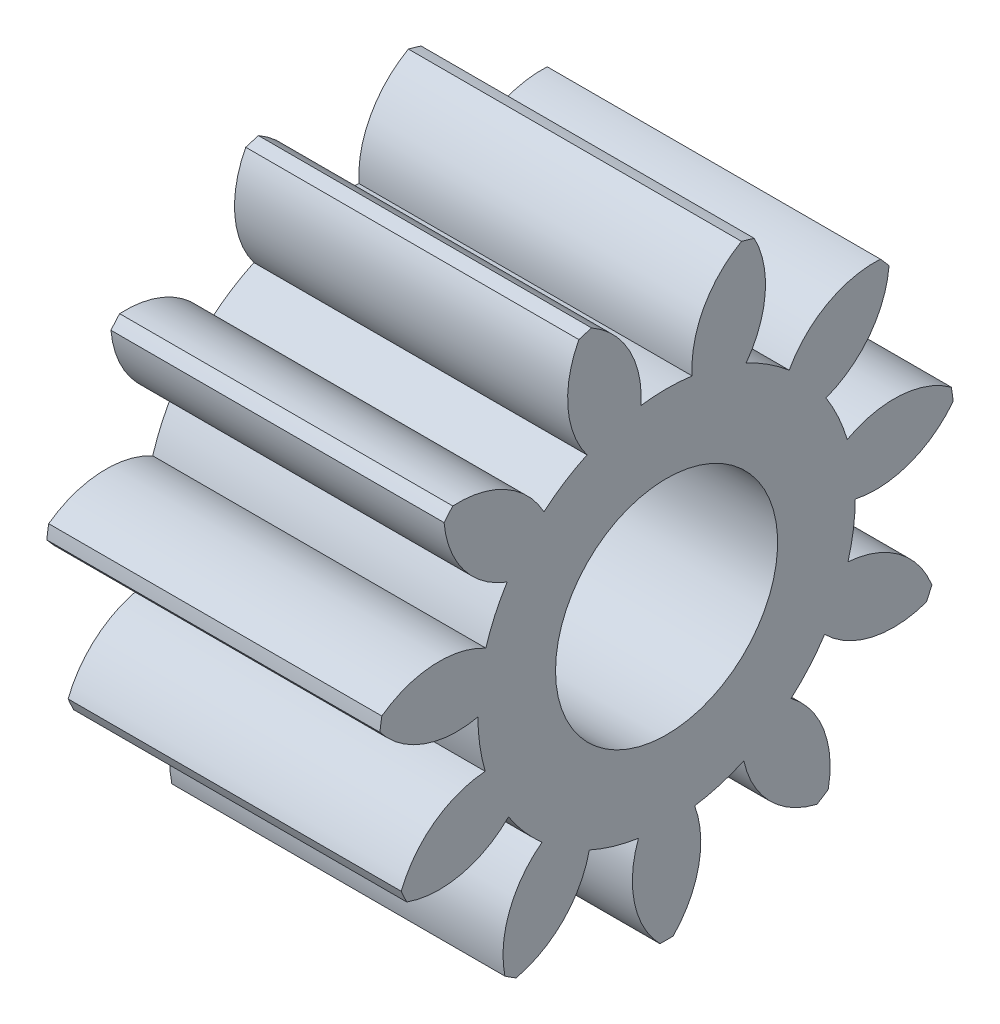
from build123d import *

# Parameters (mm, degrees)
BASPROSKE_W     = 4.5
BASPROSKE_H     = 3.9
TOOTHCUT_DEPTH  = 8.118286311
TEETHCUTS_COUNT = 11
TEETHCUTS_ANGLE = 327.272727273
BORSKE_R        = 1.5
BORE_DEPTH      = 50.0000508


with BuildPart() as part:
    # BasProSke → Base-Revolve (revolve)
    with BuildSketch(Plane(origin=(0, 0, 0), x_dir=(1, 0, 0), z_dir=(0, 1, 0)), mode=Mode.PRIVATE) as base_revolve_sk:
        with Locations((2.25, 1.95)):
            Rectangle(BASPROSKE_W, BASPROSKE_H)
    revolve(base_revolve_sk.sketch.rotate(Axis((-10, 0, 0), (1, 0, 0)), 180), axis=Axis((-10, 0, 0), (1, 0, 0)))

    # TooCutSke → ToothCut (cut, through all)
    with BuildSketch(Plane(origin=(0, 0, 0), x_dir=(0, 0, -1), z_dir=(1, 0, 0))):
        with BuildLine():
            ThreePointArc((0.345926135, 2.525418007), (0, 2.549), (-0.345926135, 2.525418007))
            ThreePointArc((-0.345926135, 2.525418007), (-0.508630204, 3.258246769), (-1.044575138, 3.783864155))
            ThreePointArc((-1.044575138, 3.783864155), (0, 3.9254), (1.044575138, 3.783864155))
            ThreePointArc((1.044575138, 3.783864155), (0.508630204, 3.258246769), (0.345926135, 2.525418007))
        make_face()
    toothcut = extrude(amount=TOOTHCUT_DEPTH, mode=Mode.SUBTRACT)

    # TeethCuts: ToothCut ×11 about axis
    teethcuts_axis = Axis((-10, 0, 0), (1, 0, 0))
    for i in range(1, TEETHCUTS_COUNT):
        add(toothcut.rotate(teethcuts_axis, i * TEETHCUTS_ANGLE / (TEETHCUTS_COUNT - 1)), mode=Mode.SUBTRACT)

    # BorSke → Bore (cut, symmetric)
    with BuildSketch(Plane(origin=(0, 0, 0), x_dir=(0, 0, -1), z_dir=(1, 0, 0))):
        with Locations(Location((0, 0, 0), (0, 0, 180))):
            Circle(BORSKE_R)
    extrude(amount=BORE_DEPTH, both=True, mode=Mode.SUBTRACT)


solid = part.part
